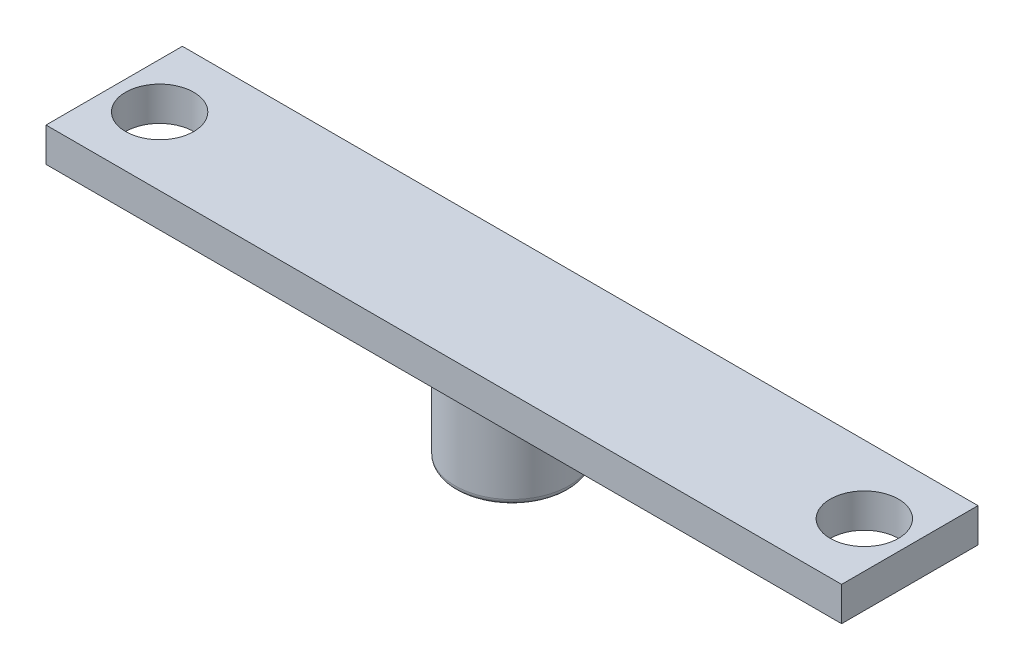
from build123d import *

# Parameters (mm, degrees)
SKETCH1_W           = 70
SKETCH1_H           = 12
BOSS_EXTRUDE1_DEPTH = 3
SKETCH3_R           = 3
CUT_EXTRUDE1_DEPTH  = 36.637059362
SKETCH4_R           = 5
BOSS_EXTRUDE2_DEPTH = 8
FILLET2_R           = 0.5


with BuildPart() as part:
    # Sketch1 → Boss-Extrude1 (new body)
    with BuildSketch(Plane(origin=(0, 0, 0), x_dir=(1, 0, 0), z_dir=(0, 1, 0))):
        Rectangle(SKETCH1_W, SKETCH1_H)
    extrude(amount=BOSS_EXTRUDE1_DEPTH)

    # Sketch3 → Cut-Extrude1 (cut, through all)
    with BuildSketch(Plane(origin=(0, 3, 0), x_dir=(1, 0, 0), z_dir=(0, 1, 0))):
        with Locations(Location((-31, 0, 0), (0, 0, 270))):
            Circle(SKETCH3_R)
        with Locations(Location((31, 0, 0), (0, 0, 270))):
            Circle(SKETCH3_R)
    extrude(amount=-CUT_EXTRUDE1_DEPTH, mode=Mode.SUBTRACT)

    # Sketch4 → Boss-Extrude2 (add)
    with BuildSketch(Plane.XZ):
        with Locations(Location((0, 0, 0), (0, 0, 270))):
            Circle(SKETCH4_R)
    extrude(amount=BOSS_EXTRUDE2_DEPTH)

    # Fillet2
    fillet2_edges = [part.edges().sort_by_distance(p)[0] for p in [
        (0, 0, 5),
        (0, -8, 5),
    ]]
    fillet(fillet2_edges, radius=FILLET2_R)


solid = part.part
